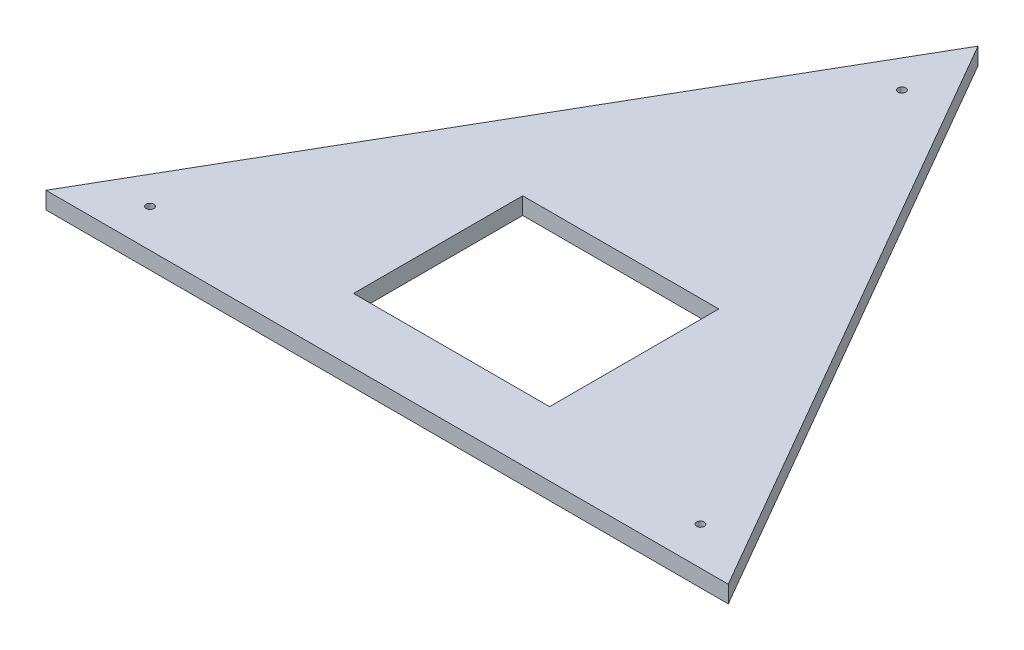
from build123d import *

# Parameters (mm, degrees)
BOSS_EXTRUDE1_DEPTH = 6.35
SKETCH2_W           = 36.5
SKETCH2_H           = 63
SKETCH2_R           = 1.4224
CUT_EXTRUDE2_DEPTH  = 195.099602868


with BuildPart() as part:
    # Sketch1 → Boss-Extrude1 (new body)
    with BuildSketch(Plane(origin=(0, 0, 0), x_dir=(1, 0, 0), z_dir=(0, 1, 0))):
        Polygon((0, 146.646968374), (-127, -73.323484187), (127, -73.323484187), align=None)
    extrude(amount=BOSS_EXTRUDE1_DEPTH)

    # Sketch2 → Cut-Extrude2 (cut, through all)
    with BuildSketch(Plane(origin=(0, 6.35, 0), x_dir=(1, 0, 0), z_dir=(0, 1, 0))):
        with Locations((-18.25, -17.853484187)):
            Rectangle(SKETCH2_W, SKETCH2_H)
        with Locations((18.25, -17.853484187)):
            Rectangle(SKETCH2_W, SKETCH2_H)
        with Locations(Location((0, 118.312139176, 0), (0, 0, 270))):
            Circle(SKETCH2_R)
        with Locations(Location((-102.461318102, -59.156069588, 0), (0, 0, 270))):
            Circle(SKETCH2_R)
        with Locations(Location((102.461318102, -59.156069588, 0), (0, 0, 270))):
            Circle(SKETCH2_R)
    extrude(amount=-CUT_EXTRUDE2_DEPTH, mode=Mode.SUBTRACT)


solid = part.part
